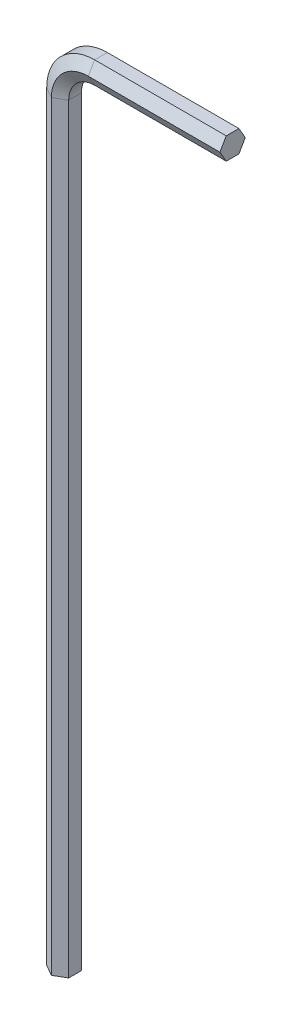
from build123d import *


with BuildPart() as part:
    # Sweep1: sweep along a path in Sketch1
    with BuildLine(Plane.XY) as sweep1_path:
        Line((0, 0), (0, 82.31001))
        ThreePointArc((0, 82.31001), (1.171572875, 85.138437125), (4, 86.31001))
        Line((4, 86.31001), (18.25001, 86.31001))
    # Sketch2 → Sweep1 (sweep)
    with BuildSketch(Plane(origin=(0, 0, 0), x_dir=(1, 0, 0), z_dir=(0, 1, 0))):
        Polygon((0, 1.374082094), (-1.18999, 0.687041047), (-1.18999, -0.687041047), (0, -1.374082094), (1.18999, -0.687041047), (1.18999, 0.687041047), align=None)
    sweep(path=sweep1_path.line)


solid = part.part
